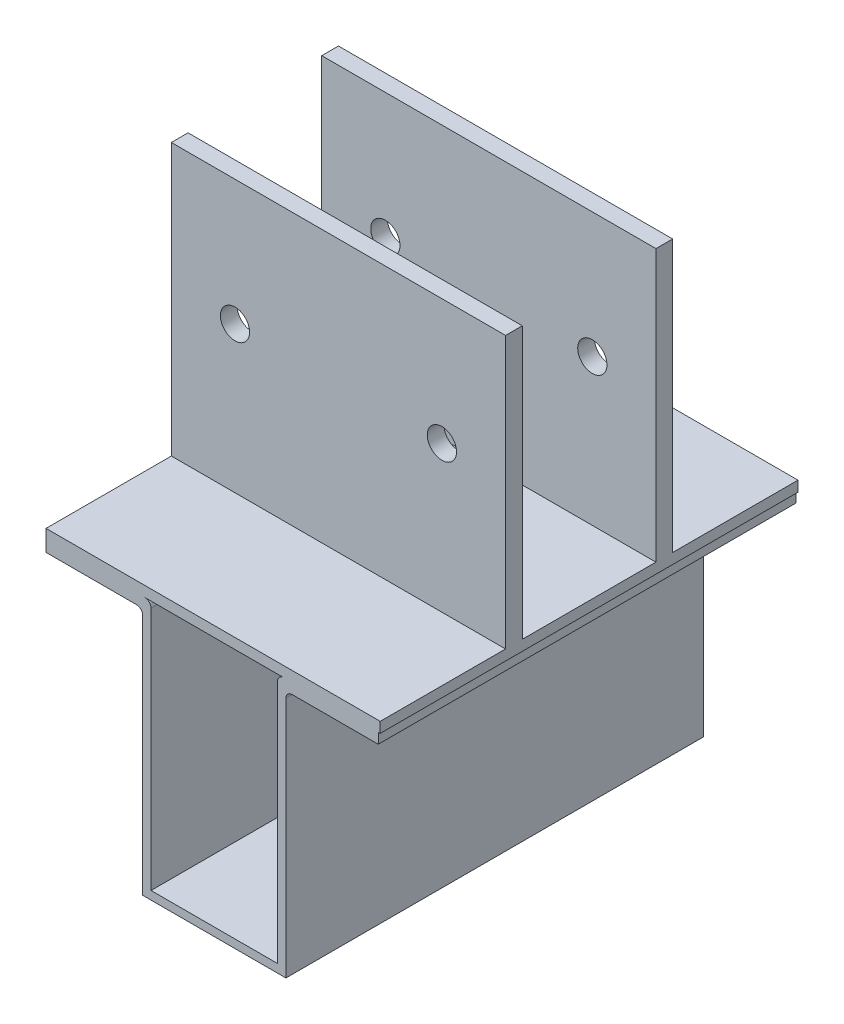
from build123d import *

# Parameters (mm, degrees)
CROQUIS1_W              = 80
CROQUIS1_H              = 200
SALIENTE_EXTRUIR1_DEPTH = 5
CROQUIS2_W              = 80
CROQUIS2_H              = 8
SALIENTE_EXTRUIR2_DEPTH = 130
CROQUIS3_R              = 7
CORTAR_EXTRUIR1_DEPTH   = 199.557296517
SALIENTE_EXTRUIR3_DEPTH = 200


with BuildPart() as part:
    # Croquis1 → Saliente-Extruir1 (new body)
    with BuildSketch(Plane(origin=(0, 0, 0), x_dir=(1, 0, 0), z_dir=(0, 1, 0))):
        Rectangle(CROQUIS1_W, CROQUIS1_H)
    saliente_extruir1 = extrude(amount=SALIENTE_EXTRUIR1_DEPTH)

    # Croquis2 → Saliente-Extruir2 (add)
    with BuildSketch(Plane(origin=(0, 5, 0), x_dir=(1, 0, 0), z_dir=(0, 1, 0))):
        with Locations((0, -36)):
            Rectangle(CROQUIS2_W, CROQUIS2_H)
        with Locations((0, 36)):
            Rectangle(CROQUIS2_W, CROQUIS2_H)
    saliente_extruir2 = extrude(amount=SALIENTE_EXTRUIR2_DEPTH)

    # Croquis3 → Cortar-Extruir1 (cut, through all)
    with BuildSketch(Plane.XY.offset(40)):
        with Locations((-9.539199318, 75)):
            Circle(CROQUIS3_R)
    cortar_extruir1 = extrude(amount=-CORTAR_EXTRUIR1_DEPTH, mode=Mode.SUBTRACT)

    # Simetría1: Saliente-Extruir1, Saliente-Extruir2, Cortar-Extruir1 across plane
    add(saliente_extruir1.mirror(Plane(origin=(40, 5, 100), x_dir=(0, 0, 1), z_dir=(-1, 0, 0))))
    add(saliente_extruir2.mirror(Plane(origin=(40, 5, 100), x_dir=(0, 0, 1), z_dir=(-1, 0, 0))))
    add(cortar_extruir1.mirror(Plane(origin=(40, 5, 100), x_dir=(0, 0, 1), z_dir=(-1, 0, 0))), mode=Mode.SUBTRACT)

    # Croquis4 → Saliente-Extruir3 (add)
    with BuildSketch(Plane(origin=(0, 0, -100), x_dir=(-1, 0, 0), z_dir=(0, 0, -1))):
        with BuildLine():
            Line((-6.271231435, -124), (-6.271231435, -7.977831946))
            ThreePointArc((-6.271231435, -7.977831946), (-5.392551778, -5.856511602), (-3.271231435, -4.977831946))
            Line((-3.271231435, -4.977831946), (40.000969046, -4.977831946))
            Line((40.000969046, -4.977831946), (40.000969046, 0))
            Line((40.000969046, 0), (40, 0))
            Line((40, 0), (-7.271231435, 0))
            ThreePointArc((-7.271231435, 0), (-9.392551778, -0.878679656), (-10.271231435, -3))
            Line((-10.271231435, -3), (-10.271231435, -4.977831946))
            Line((-10.271231435, -4.977831946), (-10.271231435, -120))
            Line((-10.271231435, -120), (-70.845112341, -120))
            Line((-70.845112341, -120), (-70.845112341, -4.977831946))
            Line((-70.845112341, -4.977831946), (-70.845112341, -3))
            ThreePointArc((-70.845112341, -3), (-71.723791998, -0.878679656), (-73.845112341, 0))
            Line((-73.845112341, 0), (-119.056976736, 0))
            Line((-119.056976736, 0), (-119.056976736, -4.977831946))
            Line((-119.056976736, -4.977831946), (-77.845112341, -4.977831946))
            ThreePointArc((-77.845112341, -4.977831946), (-75.723791998, -5.856511602), (-74.845112341, -7.977831946))
            Line((-74.845112341, -7.977831946), (-74.845112341, -124))
            Line((-74.845112341, -124), (-6.271231435, -124))
        make_face()
    extrude(amount=-SALIENTE_EXTRUIR3_DEPTH)


solid = part.part
